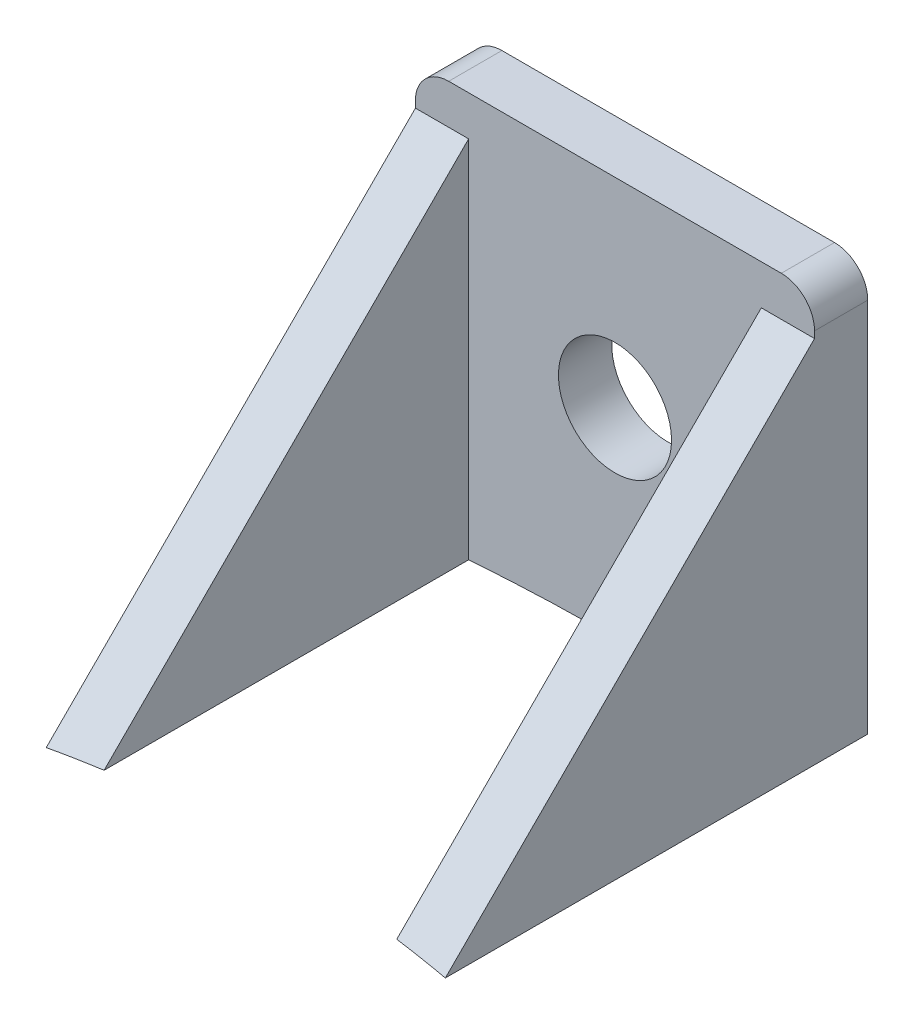
from build123d import *

# Parameters (mm, degrees)
ESQUISSE1_W             = 30
ESQUISSE1_H             = 33
ESQUISSE1_R             = 4.25
BOSS_EXTRU_1_DEPTH      = 4
CONG_1_R                = 2.5
BOSS_EXTRU_2_DEPTH      = 4
BOSS_EXTRU_3_DEPTH      = 4
ESQUISSE5_R             = 150
ENL_V_MAT_EXTRU_1_DEPTH = 42.291645644


with BuildPart() as part:
    # Esquisse1 → Boss.-Extru.1 (new body)
    with BuildSketch(Plane.XY):
        with Locations((0, -1.5)):
            Rectangle(ESQUISSE1_W, ESQUISSE1_H)
        Circle(ESQUISSE1_R, mode=Mode.SUBTRACT)
    extrude(amount=BOSS_EXTRU_1_DEPTH)

    # Congé1
    cong_1_edges = [part.edges().sort_by_distance(p)[0] for p in [
        (-15, 15, 2),
        (15, 15, 2),
    ]]
    fillet(cong_1_edges, radius=CONG_1_R)

    # Esquisse2 → Boss.-Extru.2 (add)
    with BuildSketch(Plane(origin=(15, 0, 0), x_dir=(0, 0, -1), z_dir=(1, 0, 0))):
        Polygon((-4, -18), (-34, -18), (-4, 12), align=None)
    extrude(amount=-BOSS_EXTRU_2_DEPTH)

    # Esquisse4 → Boss.-Extru.3 (add)
    with BuildSketch(Plane.ZY.offset(15)):
        Polygon((4, -18), (34, -18), (4, 12), align=None)
    extrude(amount=-BOSS_EXTRU_3_DEPTH)

    # Esquisse5 → Enlèv. mat.-Extru.1 (cut, through all)
    with BuildSketch(Plane(origin=(0, 0, 0), x_dir=(-1, 0, 0), z_dir=(0, 0, -1))):
        with Locations((0, -165)):
            Circle(ESQUISSE5_R)
    extrude(amount=-ENL_V_MAT_EXTRU_1_DEPTH, mode=Mode.SUBTRACT)


solid = part.part
